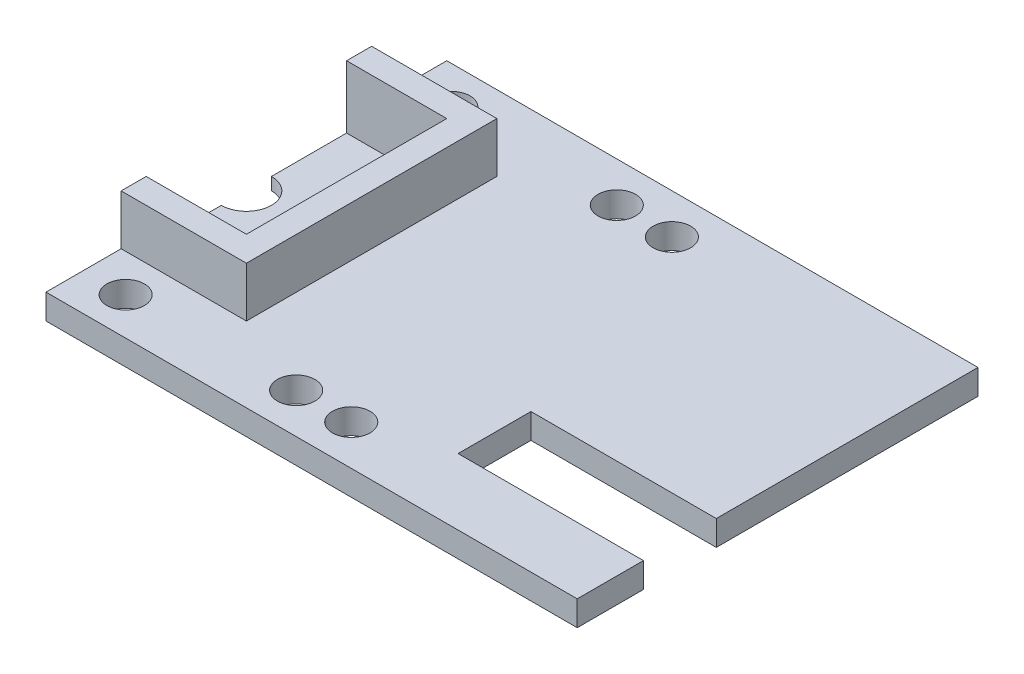
from build123d import *

# Parameters (mm, degrees)
SKETCH1_W                = 279.4
SKETCH1_H                = 101.6
BOSS_EXTRUDE1_DEPTH      = 6.35
SKETCH2_R                = 13.97
BOSS_EXTRUDE3_DEPTH      = 5.55625
SKETCH9_R                = 11.1125
CUT_EXTRUDE4_DEPTH       = 4.445
CUT_EXTRUDE5_START       = -5.55625
SKETCH10_R               = 11.1125
CUT_EXTRUDE5_DEPTH       = 5.55625
SKETCH11_R               = 7.9375
CUT_EXTRUDE6_DEPTH       = 285.078633923
SKETCH12_R               = 6.35
CUT_EXTRUDE7_DEPTH       = 285.051619429
SKETCH22_W               = 63.5
SKETCH22_H               = 63.5
BOSS_EXTRUDE7_DEPTH      = 12.7
SKETCH25_W               = 50.8
SKETCH25_H               = 50.8
CUT_EXTRUDE11_DEPTH      = 15.875
SKETCH32_R               = 4.7625
CUT_EXTRUDE12_DEPTH      = 6.35
SKETCH38_W               = 46.99
SKETCH38_H               = 18.470251096
CUT_EXTRUDE13_DEPTH      = 6.35
SKETCH60_R               = 4.7625
CUT_EXTRUDE23_DEPTH      = 6.35
CUT_EXTRUDE26_DEPTH      = 285.264471927
CUT_EXTRUDE26_DEPTH_BACK = 285.264471927
SKETCH63_R               = 4.7625
CUT_EXTRUDE27_DEPTH      = 145.488464724


with BuildPart() as part:
    # Sketch1 → Boss-Extrude1 (new body)
    with BuildSketch(Plane(origin=(0, 0, 0), x_dir=(1, 0, 0), z_dir=(0, 1, 0))):
        with Locations((-139.7, 0)):
            Rectangle(SKETCH1_W, SKETCH1_H)
    extrude(amount=BOSS_EXTRUDE1_DEPTH)

    # Sketch2 → Boss-Extrude3 (add)
    with BuildSketch(Plane(origin=(0, 6.35, 0), x_dir=(1, 0, 0), z_dir=(0, 1, 0))):
        with Locations(Location((-258.510557857, 0, 0), (0, 0, 90))):
            Circle(SKETCH2_R)
    extrude(amount=BOSS_EXTRUDE3_DEPTH)

    # Sketch9 → Cut-Extrude4 (cut)
    with BuildSketch(Plane(origin=(0, 11.90625, 0), x_dir=(1, 0, 0), z_dir=(0, 1, 0))):
        with Locations(Location((-258.510557857, 0, 0), (0, 0, 270))):
            Circle(SKETCH9_R)
    extrude(amount=-CUT_EXTRUDE4_DEPTH, mode=Mode.SUBTRACT)

    # Sketch10 → Cut-Extrude5 (cut)
    with BuildSketch(Plane(origin=(0, 0, 0), x_dir=(-1, 0, 0), z_dir=(0, -1, 0)).offset(CUT_EXTRUDE5_START)):
        with Locations(Location((258.510557857, 0, 0), (0, 0, 270))):
            Circle(SKETCH10_R)
    extrude(amount=CUT_EXTRUDE5_DEPTH, mode=Mode.SUBTRACT)

    # Sketch11 → Cut-Extrude6 (cut, through all)
    with BuildSketch(Plane(origin=(0, 7.46125, 0), x_dir=(1, 0, 0), z_dir=(0, 1, 0))):
        with Locations(Location((-258.510557857, 0, 0), (0, 0, 270))):
            Circle(SKETCH11_R)
    extrude(amount=-CUT_EXTRUDE6_DEPTH, mode=Mode.SUBTRACT)

    # Sketch12 → Cut-Extrude7 (cut, through all)
    with BuildSketch(Plane(origin=(0, 6.35, 0), x_dir=(1, 0, 0), z_dir=(0, 1, 0))):
        with Locations(Location((-134.666203771, 0, 0), (0, 0, 270))):
            Circle(SKETCH12_R)
    extrude(amount=-CUT_EXTRUDE7_DEPTH, mode=Mode.SUBTRACT)

    # Sketch22 → Boss-Extrude7 (add)
    with BuildSketch(Plane(origin=(0, 6.35, 0), x_dir=(1, 0, 0), z_dir=(0, 1, 0))):
        with Locations((-134.666203771, 0)):
            Rectangle(SKETCH22_W, SKETCH22_H)
    extrude(amount=BOSS_EXTRUDE7_DEPTH)

    # Sketch25 → Cut-Extrude11 (cut)
    with BuildSketch(Plane(origin=(0, 19.05, 0), x_dir=(1, 0, 0), z_dir=(0, 1, 0))):
        with Locations((-134.666203771, 0)):
            Rectangle(SKETCH25_W, SKETCH25_H)
    extrude(amount=-CUT_EXTRUDE11_DEPTH, mode=Mode.SUBTRACT)

    # Sketch32 → Cut-Extrude12 (cut)
    with BuildSketch(Plane(origin=(0, 6.35, 0), x_dir=(1, 0, 0), z_dir=(0, 1, 0))):
        with Locations(Location((-67.44195898, -40.64, 0), (0, 0, 270))):
            Circle(SKETCH32_R)
        with Locations(Location((-81.41195898, -40.64, 0), (0, 0, 270))):
            Circle(SKETCH32_R)
        with Locations(Location((-67.44195898, 40.64, 0), (0, 0, 270))):
            Circle(SKETCH32_R)
        with Locations(Location((-81.41195898, 40.64, 0), (0, 0, 270))):
            Circle(SKETCH32_R)
    extrude(amount=-CUT_EXTRUDE12_DEPTH, mode=Mode.SUBTRACT)

    # Sketch38 → Cut-Extrude13 (cut)
    with BuildSketch(Plane(origin=(0, 6.35, 0), x_dir=(1, 0, 0), z_dir=(0, 1, 0))):
        with Locations((-23.495, -24.777709652)):
            Rectangle(SKETCH38_W, SKETCH38_H)
    extrude(amount=-CUT_EXTRUDE13_DEPTH, mode=Mode.SUBTRACT)

    # Sketch60 → Cut-Extrude23 (cut)
    with BuildSketch(Plane(origin=(0, 6.35, 0), x_dir=(1, 0, 0), z_dir=(0, 1, 0))):
        with Locations(Location((-231.7492444, 41.324145444, 0), (0, 0, 270))):
            Circle(SKETCH60_R)
        with Locations(Location((-231.7492444, -39.369341378, 0), (0, 0, 270))):
            Circle(SKETCH60_R)
        with Locations(Location((-173.509244294, -39.369341378, 0), (0, 0, 270))):
            Circle(SKETCH60_R)
        with Locations(Location((-173.509244294, 41.324145444, 0), (0, 0, 270))):
            Circle(SKETCH60_R)
    extrude(amount=-CUT_EXTRUDE23_DEPTH, mode=Mode.SUBTRACT)

    # Sketch62 → Cut-Extrude26 (cut, two sides: drawn at the far end of the back side and taken through both)
    with BuildSketch(Plane(origin=(0, 6.35, 0), x_dir=(1, 0, 0), z_dir=(0, 1, 0)).offset(-CUT_EXTRUDE26_DEPTH_BACK)):
        Polygon((-134.666203771, -414.468951257), (-134.666203771, -50.8), (-134.666203771, 0), (-134.666203771, 50.8), (-134.666203771, 414.468951257), (-862.004106285, 414.468951257), (-862.004106285, -414.468951257), align=None)
    extrude(amount=CUT_EXTRUDE26_DEPTH + CUT_EXTRUDE26_DEPTH_BACK, mode=Mode.SUBTRACT)

    # Sketch63 → Cut-Extrude27 (cut, through all)
    with BuildSketch(Plane(origin=(0, 6.35, 0), x_dir=(1, 0, 0), z_dir=(0, 1, 0))):
        with Locations(Location((-123.998203771, 41.275, 0), (0, 0, 270))):
            Circle(SKETCH63_R)
    cut_extrude27 = extrude(amount=-CUT_EXTRUDE27_DEPTH, mode=Mode.SUBTRACT)

    # Mirror1: Cut-Extrude27 across plane
    add(cut_extrude27.mirror(Plane.XY), mode=Mode.SUBTRACT)


solid = part.part
